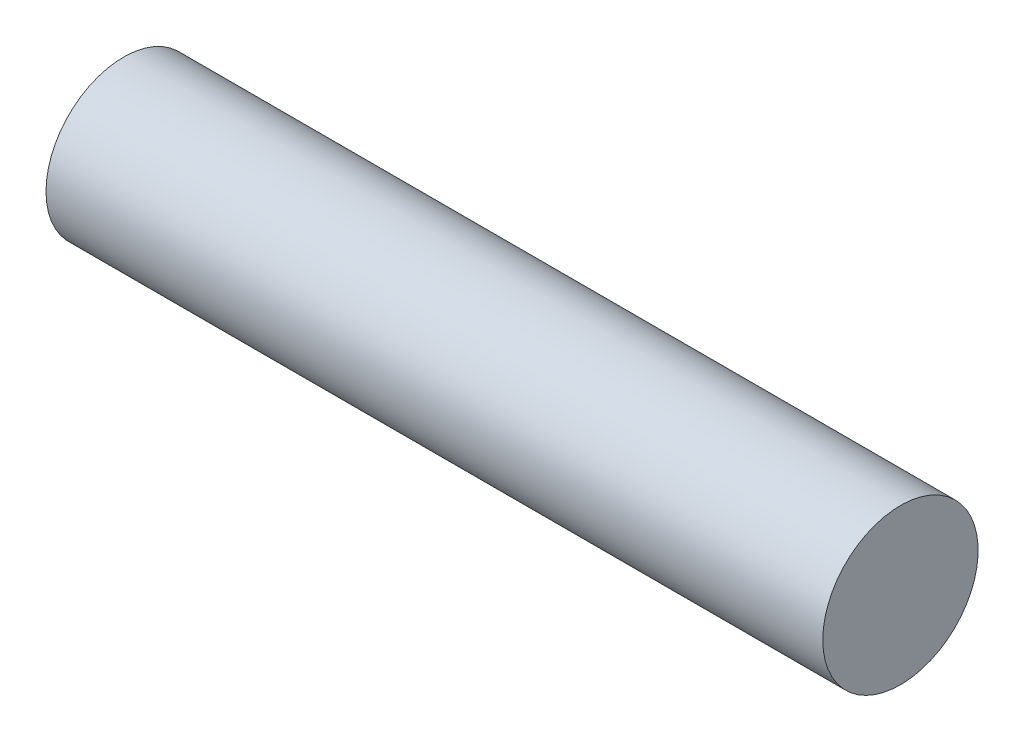
from build123d import *

# Parameters (mm, degrees)
SKETCH_1_W = 5
SKETCH_1_H = 0.5


with BuildPart() as part:
    # Эскиз1 → Повернуть1 (revolve)
    with BuildSketch(Plane(origin=(0, 0, 0), x_dir=(1, 0, 0), z_dir=(0, 1, 0)), mode=Mode.PRIVATE) as revolve_1_sk:
        with Locations((-2.5, 0.25)):
            Rectangle(SKETCH_1_W, SKETCH_1_H)
    revolve(revolve_1_sk.sketch.rotate(Axis((-5, 0, 0), (1, 0, 0)), 180), axis=Axis((-5, 0, 0), (1, 0, 0)))


solid = part.part
